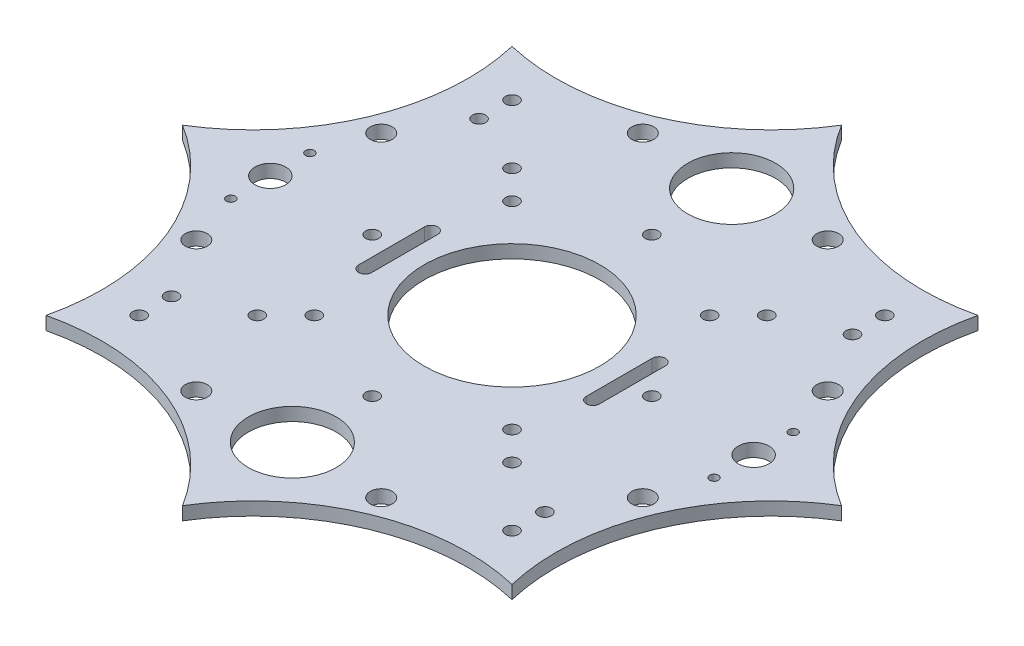
from build123d import *

# Parameters (mm, degrees)
SKETCH_1_R          = 1.5
SKETCH_1_R_2        = 20
SKETCH_1_R_3        = 2.5
SKETCH_1_R_4        = 10
EXTRUDE_2_DEPTH     = 3
SKETCH_2_R          = 1
SKETCH_2_R_2        = 3.5
CUT_EXTRUDE_1_DEPTH = 3
SKETCH_3_R          = 1.5
CUT_EXTRUDE_2_DEPTH = 10


with BuildPart() as part:
    # 草圖1 → 填料-伸長2 (new body)
    with BuildSketch(Plane(origin=(0, 0, 0), x_dir=(1, 0, 0), z_dir=(0, 1, 0))):
        with BuildLine():
            ThreePointArc((-53.033008589, 53.033008589), (-22.961005942, 55.432771951), (0, 75))
            ThreePointArc((0, 75), (22.961005942, 55.432771951), (53.033008589, 53.033008589))
            ThreePointArc((53.033008589, 53.033008589), (55.432771951, 22.961005942), (75, 0))
            ThreePointArc((75, 0), (55.432771951, -22.961005942), (53.033008589, -53.033008589))
            ThreePointArc((53.033008589, -53.033008589), (22.961005942, -55.432771951), (0, -75))
            ThreePointArc((0, -75), (-22.961005942, -55.432771951), (-53.033008589, -53.033008589))
            ThreePointArc((-53.033008589, -53.033008589), (-55.432771951, -22.961005942), (-75, 0))
            ThreePointArc((-75, 0), (-55.432771951, 22.961005942), (-53.033008589, 53.033008589))
        make_face()
        with Locations(Location((-42.426406871, 42.426406871, 0), (0, 0, 270))):
            Circle(SKETCH_1_R, mode=Mode.SUBTRACT)
        with Locations(Location((-28.991378029, 28.991378029, 0), (0, 0, 270))):
            Circle(SKETCH_1_R, mode=Mode.SUBTRACT)
        with Locations(Location((28.991378029, -28.991378029, 0), (0, 0, 270))):
            Circle(SKETCH_1_R, mode=Mode.SUBTRACT)
        with Locations(Location((42.426406871, -42.426406871, 0), (0, 0, 270))):
            Circle(SKETCH_1_R, mode=Mode.SUBTRACT)
        with Locations(Location((42.426406871, 42.426406871, 0), (0, 0, 270))):
            Circle(SKETCH_1_R, mode=Mode.SUBTRACT)
        with Locations(Location((28.991378029, 28.991378029, 0), (0, 0, 270))):
            Circle(SKETCH_1_R, mode=Mode.SUBTRACT)
        with Locations(Location((-28.991378029, -28.991378029, 0), (0, 0, 270))):
            Circle(SKETCH_1_R, mode=Mode.SUBTRACT)
        with Locations(Location((-42.426406871, -42.426406871, 0), (0, 0, 270))):
            Circle(SKETCH_1_R, mode=Mode.SUBTRACT)
        with Locations(Location((0, 0, 0), (0, 0, 270))):
            Circle(SKETCH_1_R_2, mode=Mode.SUBTRACT)
        with Locations(Location((0, 31.819805153, 0), (0, 0, 270))):
            Circle(SKETCH_1_R, mode=Mode.SUBTRACT)
        with Locations(Location((31.819805153, 0, 0), (0, 0, 270))):
            Circle(SKETCH_1_R, mode=Mode.SUBTRACT)
        with Locations(Location((22.5, 22.5, 0), (0, 0, 270))):
            Circle(SKETCH_1_R, mode=Mode.SUBTRACT)
        with Locations(Location((0, -31.819805153, 0), (0, 0, 270))):
            Circle(SKETCH_1_R, mode=Mode.SUBTRACT)
        with Locations(Location((-22.5, -22.5, 0), (0, 0, 270))):
            Circle(SKETCH_1_R, mode=Mode.SUBTRACT)
        with Locations(Location((-31.819805153, 0, 0), (0, 0, 270))):
            Circle(SKETCH_1_R, mode=Mode.SUBTRACT)
        with Locations(Location((-22.5, 22.5, 0), (0, 0, 270))):
            Circle(SKETCH_1_R, mode=Mode.SUBTRACT)
        with Locations(Location((22.5, -22.5, 0), (0, 0, 270))):
            Circle(SKETCH_1_R, mode=Mode.SUBTRACT)
        with Locations(Location((-21.04758878, 50.813374288, 0), (0, 0, 270))):
            Circle(SKETCH_1_R_3, mode=Mode.SUBTRACT)
        with Locations(Location((21.04758878, 50.813374288, 0), (0, 0, 270))):
            Circle(SKETCH_1_R_3, mode=Mode.SUBTRACT)
        with Locations(Location((50.813374288, 21.04758878, 0), (0, 0, 270))):
            Circle(SKETCH_1_R_3, mode=Mode.SUBTRACT)
        with Locations(Location((50.813374288, -21.04758878, 0), (0, 0, 270))):
            Circle(SKETCH_1_R_3, mode=Mode.SUBTRACT)
        with Locations(Location((21.04758878, -50.813374288, 0), (0, 0, 270))):
            Circle(SKETCH_1_R_3, mode=Mode.SUBTRACT)
        with Locations(Location((-21.04758878, -50.813374288, 0), (0, 0, 270))):
            Circle(SKETCH_1_R_3, mode=Mode.SUBTRACT)
        with Locations(Location((-50.813374288, -21.04758878, 0), (0, 0, 270))):
            Circle(SKETCH_1_R_3, mode=Mode.SUBTRACT)
        with Locations(Location((-50.813374288, 21.04758878, 0), (0, 0, 270))):
            Circle(SKETCH_1_R_3, mode=Mode.SUBTRACT)
        with Locations(Location((0, 50, 0), (0, 0, 270))):
            Circle(SKETCH_1_R_4, mode=Mode.SUBTRACT)
        with Locations(Location((0, -50, 0), (0, 0, 270))):
            Circle(SKETCH_1_R_4, mode=Mode.SUBTRACT)
        with BuildLine():
            Line((-24.409902577, 7.5), (-24.409902577, -7.5))
            ThreePointArc((-24.409902577, -7.5), (-25.909902577, -9), (-27.409902577, -7.5))
            Line((-27.409902577, -7.5), (-27.409902577, 7.5))
            ThreePointArc((-27.409902577, 7.5), (-25.909902577, 9), (-24.409902577, 7.5))
        make_face(mode=Mode.SUBTRACT)
        with BuildLine():
            Line((27.409902577, 7.5), (27.409902577, -7.5))
            ThreePointArc((27.409902577, -7.5), (25.909902577, -9), (24.409902577, -7.5))
            Line((24.409902577, -7.5), (24.409902577, 7.5))
            ThreePointArc((24.409902577, 7.5), (25.909902577, 9), (27.409902577, 7.5))
        make_face(mode=Mode.SUBTRACT)
    extrude(amount=EXTRUDE_2_DEPTH)

    # 草圖2 → 除料-伸長1 (cut)
    with BuildSketch(Plane(origin=(0, 3, 0), x_dir=(1, 0, 0), z_dir=(0, 1, 0))):
        with Locations(Location((-55, 9, 0), (0, 0, 270))):
            Circle(SKETCH_2_R)
        with Locations(Location((-55, -9, 0), (0, 0, 270))):
            Circle(SKETCH_2_R)
        with Locations(Location((55, 9, 0), (0, 0, 270))):
            Circle(SKETCH_2_R)
        with Locations(Location((55, -9, 0), (0, 0, 270))):
            Circle(SKETCH_2_R)
        with Locations(Location((-55, 0, 0), (0, 0, 270))):
            Circle(SKETCH_2_R_2)
        with Locations(Location((55, 0, 0), (0, 0, 270))):
            Circle(SKETCH_2_R_2)
    extrude(amount=-CUT_EXTRUDE_1_DEPTH, mode=Mode.SUBTRACT)

    # 草圖3 → 除料-伸長2 (cut)
    with BuildSketch(Plane(origin=(0, 3, 0), x_dir=(1, 0, 0), z_dir=(0, 1, 0))):
        with Locations(Location((-42.5, 35, 0), (0, 0, 270))):
            Circle(SKETCH_3_R)
        with Locations(Location((42.5, 35, 0), (0, 0, 270))):
            Circle(SKETCH_3_R)
        with Locations(Location((42.5, -35, 0), (0, 0, 270))):
            Circle(SKETCH_3_R)
        with Locations(Location((-42.5, -35, 0), (0, 0, 270))):
            Circle(SKETCH_3_R)
    extrude(amount=-CUT_EXTRUDE_2_DEPTH, mode=Mode.SUBTRACT)


solid = part.part
